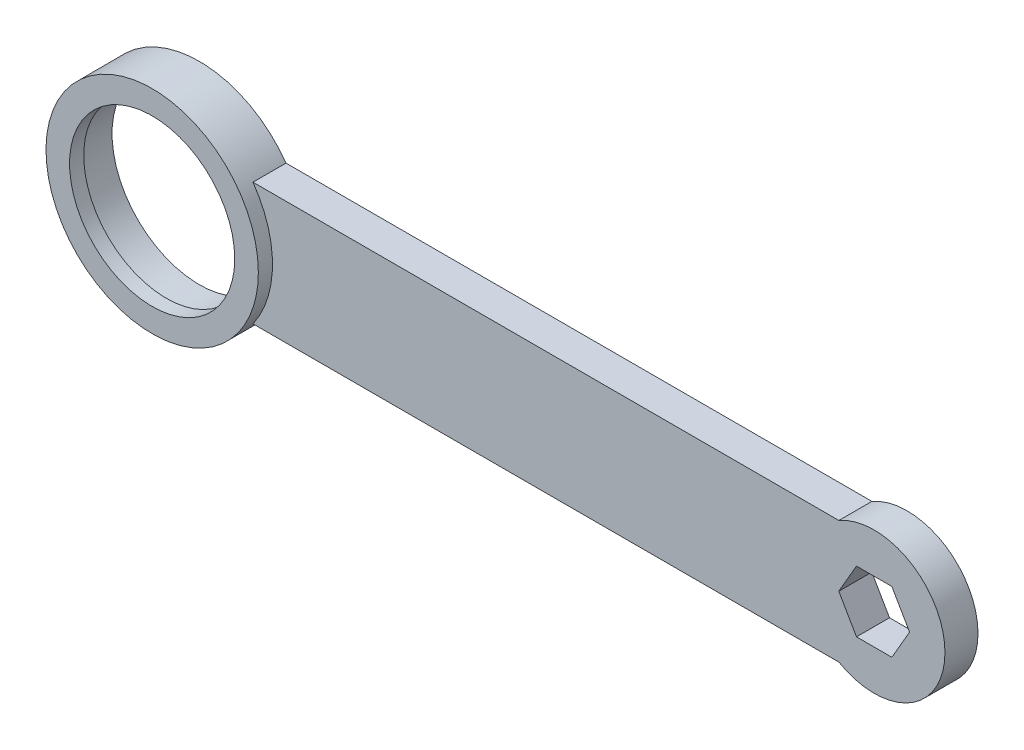
from build123d import *

# Parameters (mm, degrees)
BOSS_EXTRUDE1_DEPTH = 7
SKETCH2_R           = 22.5
BOSS_EXTRUDE2_DEPTH = 3
CUT_EXTRUDE1_DEPTH  = 101.307028667
SKETCH4_R           = 17.5
CUT_EXTRUDE2_DEPTH  = 101.560926806
SKETCH5_R           = 18.5
CUT_EXTRUDE3_DEPTH  = 7


with BuildPart() as part:
    # Sketch1 → Boss-Extrude1 (new body)
    with BuildSketch(Plane.XY):
        with BuildLine():
            Line((-56.635632328, 13), (67.516685226, 13))
            ThreePointArc((67.516685226, 13), (90, 0), (67.516685226, -13))
            Line((67.516685226, -13), (-56.635632328, -13))
            ThreePointArc((-56.635632328, -13), (-97.5, 0), (-56.635632328, 13))
        make_face()
    extrude(amount=BOSS_EXTRUDE1_DEPTH)

    # Sketch2 → Boss-Extrude2 (add)
    with BuildSketch(Plane.XY.offset(7)):
        with Locations(Location((-75, 0, 0), (0, 0, 324.705605323))):
            Circle(SKETCH2_R)
    extrude(amount=BOSS_EXTRUDE2_DEPTH)

    # Sketch3 → Cut-Extrude1 (cut, through all)
    with BuildSketch(Plane.XY.offset(7)):
        Polygon((82.5, 0), (78.75, 6.495190528), (71.25, 6.495190528), (67.5, 0), (71.25, -6.495190528), (78.75, -6.495190528), align=None)
    extrude(amount=-CUT_EXTRUDE1_DEPTH, mode=Mode.SUBTRACT)

    # Sketch4 → Cut-Extrude2 (cut, through all)
    with BuildSketch(Plane.XY.offset(10)):
        with Locations((-75, 0)):
            Circle(SKETCH4_R)
    extrude(amount=-CUT_EXTRUDE2_DEPTH, mode=Mode.SUBTRACT)

    # Sketch5 → Cut-Extrude3 (cut)
    with BuildSketch(Plane.XY):
        with Locations((-75, 0)):
            Circle(SKETCH5_R)
    extrude(amount=CUT_EXTRUDE3_DEPTH, mode=Mode.SUBTRACT)


solid = part.part
